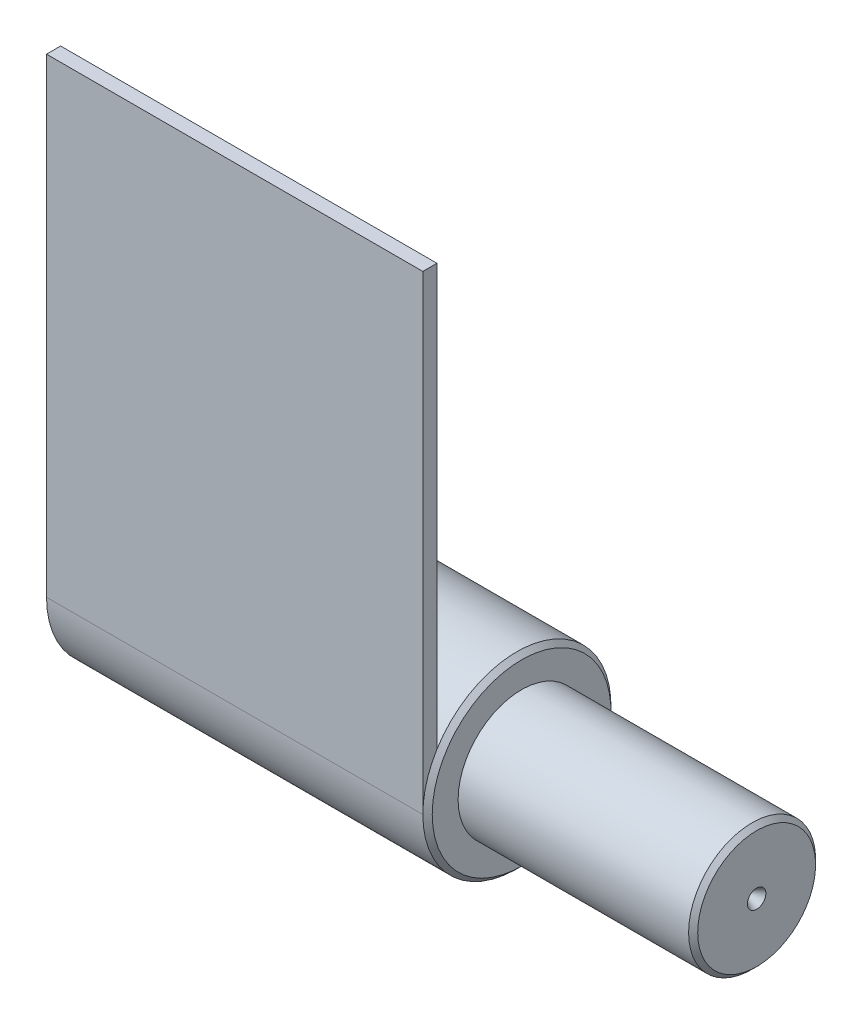
from build123d import *

# Parameters (mm, degrees)
SKETCH_3_W      = 80
SKETCH_3_H      = 3.000052495
EXTRUDE_1_DEPTH = 100


with BuildPart() as part:
    # Эскиз2 → Повернуть1 (revolve)
    with BuildSketch(Plane(origin=(0, 0, 0), x_dir=(1, 0, 0), z_dir=(0, 1, 0)), mode=Mode.PRIVATE) as revolve_1_sk:
        Polygon((-45.527497303, 22.337527379), (34.472502697, 22.337527379), (35.472502697, 21.337527379), (35.472502697, 15.837527379), (84.472502697, 15.837527379), (85.441558376, 14.8684717), (85.441558376, 4.296423316), (82.259183132, 2.337527379), (-47.527497303, 2.337527379), (-47.527497303, 20.337527379), align=None)
    revolve(revolve_1_sk.sketch.rotate(Axis((-58.608041749, 0, -2.337527379), (1, 0, 0)), 180), axis=Axis((-58.608041749, 0, -2.337527379), (1, 0, 0)))

    # Эскиз3 → Бобышка-Вытянуть1 (add)
    with BuildSketch(Plane(origin=(0, 0, 0), x_dir=(1, 0, 0), z_dir=(0, 1, 0))):
        with Locations((-5.527497303, -16.162446374)):
            Rectangle(SKETCH_3_W, SKETCH_3_H)
    extrude(amount=EXTRUDE_1_DEPTH)


solid = part.part
